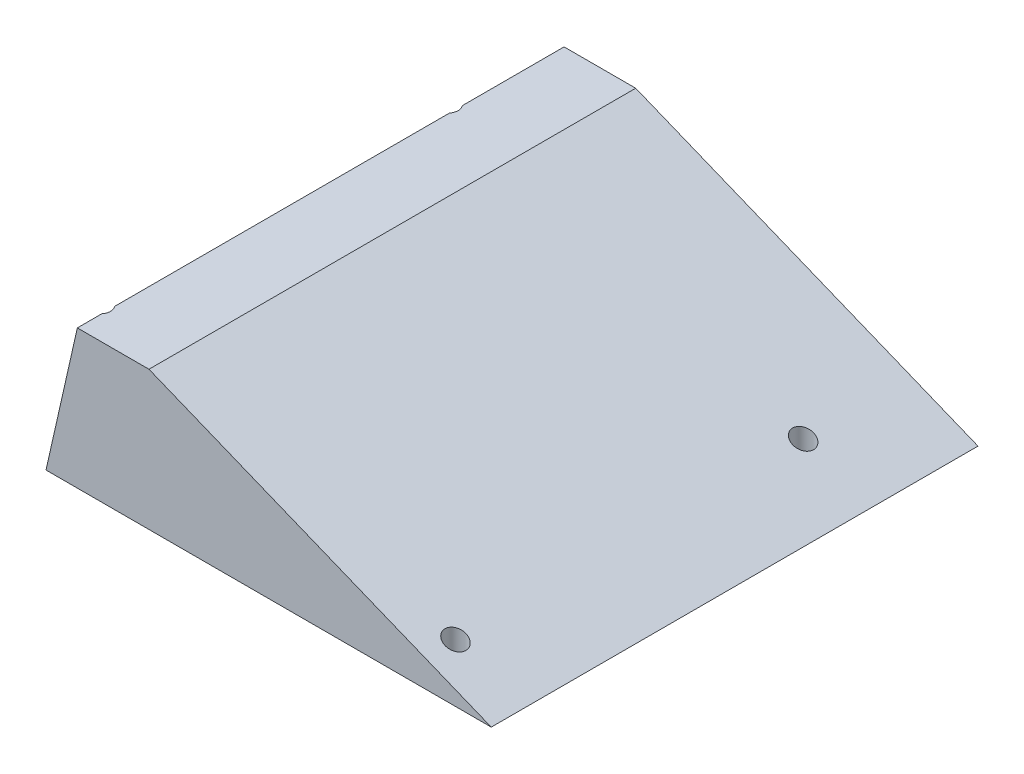
from build123d import *

# Parameters (mm, degrees)
EXTRUDE_1_DEPTH     = 63
EXTRUDE_2_DEPTH     = 6
SKETCH_3_W          = 8
SKETCH_3_H          = 10
CUT_EXTRUDE_1_DEPTH = 19
SKETCH_4_R          = 1.35
CUT_EXTRUDE_2_DEPTH = 27


with BuildPart() as part:
    # 草图1 → 凸台-拉伸1 (new body)
    with BuildSketch(Plane.XY):
        Polygon((5.368916437, 0), (10.737832874, 0), (13.433272115, 10.825245017), (27.262006405, 10.825245017), (31.5, 0), (63, 0), (18.696157585, 17.96451652), (9.426538108, 17.96451652), align=None)
    extrude(amount=EXTRUDE_1_DEPTH)

    # 草图2 → 凸台-拉伸2 (add)
    with BuildSketch(Plane.XY.offset(63)):
        Polygon((10.737832874, 0), (31.5, 0), (27.262006405, 10.825245017), (13.433272115, 10.825245017), align=None)
    extrude(amount=-EXTRUDE_2_DEPTH)

    # 草图3 → 切除-拉伸1 (cut)
    with BuildSketch(Plane(origin=(0, 0, 0), x_dir=(0, 0, -1), z_dir=(1, 0, 0))):
        with Locations((-4, 5)):
            Rectangle(SKETCH_3_W, SKETCH_3_H)
    extrude(amount=CUT_EXTRUDE_1_DEPTH, mode=Mode.SUBTRACT)

    # 草图4 → 切除-拉伸2 (cut)
    with BuildSketch(Plane.XZ):
        with Locations(Location((8.368916437, 59, 0), (0, 0, 270))):
            Circle(SKETCH_4_R)
        with Locations(Location((54.368916437, 59, 0), (0, 0, 270))):
            Circle(SKETCH_4_R)
        with Locations(Location((54.368916437, 14, 0), (0, 0, 270))):
            Circle(SKETCH_4_R)
        with Locations(Location((8.368916437, 14, 0), (0, 0, 270))):
            Circle(SKETCH_4_R)
    extrude(amount=-CUT_EXTRUDE_2_DEPTH, mode=Mode.SUBTRACT)


solid = part.part
